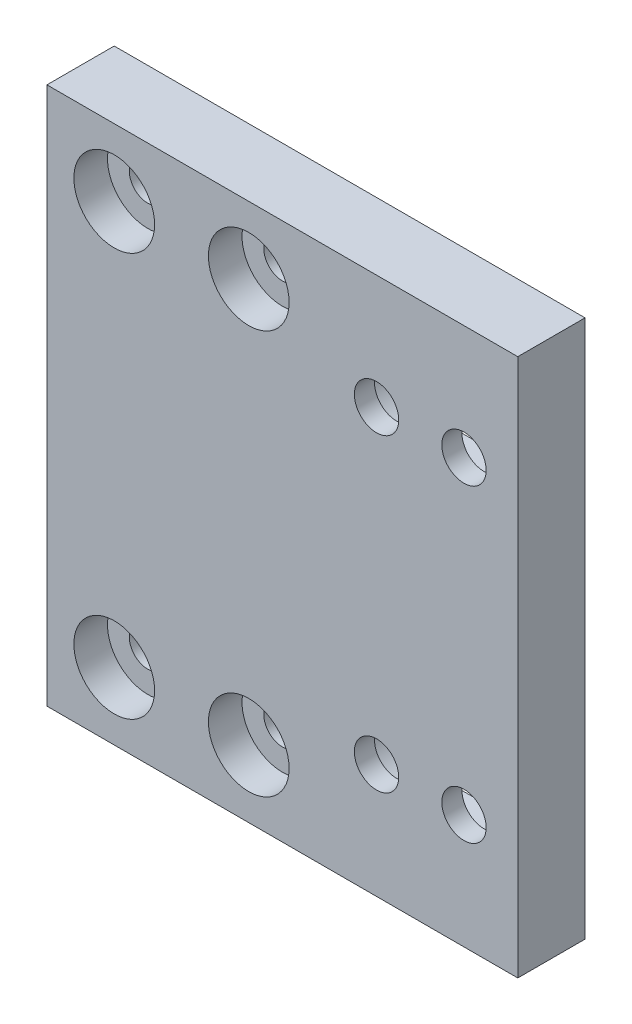
from build123d import *

# Parameters (mm, degrees)
ESQUISSE1_W             = 70
ESQUISSE1_H             = 80
ESQUISSE1_R             = 3.3
ESQUISSE1_R_2           = 2.75
BOSS_EXTRU_1_DEPTH      = 10
ESQUISSE2_R             = 6
ENL_V_MAT_EXTRU_1_DEPTH = 5
ENL_V_MAT_EXTRU_3_DEPTH = 7


with BuildPart() as part:
    # Esquisse1 → Boss.-Extru.1 (new body)
    with BuildSketch(Plane.XY):
        with Locations((-26.178136106, 1.138047212)):
            Rectangle(ESQUISSE1_W, ESQUISSE1_H)
        with Locations((0.821863894, 24.138047212)):
            Circle(ESQUISSE1_R, mode=Mode.SUBTRACT)
        with Locations((-12.178136106, 24.138047212)):
            Circle(ESQUISSE1_R, mode=Mode.SUBTRACT)
        with Locations((-12.178136106, -21.861952788)):
            Circle(ESQUISSE1_R, mode=Mode.SUBTRACT)
        with Locations((0.821863894, -21.861952788)):
            Circle(ESQUISSE1_R, mode=Mode.SUBTRACT)
        with Locations((-51.178136106, 31.138047212)):
            Circle(ESQUISSE1_R_2, mode=Mode.SUBTRACT)
        with Locations((-31.178136106, 31.138047212)):
            Circle(ESQUISSE1_R_2, mode=Mode.SUBTRACT)
        with Locations((-31.178136106, -28.861952788)):
            Circle(ESQUISSE1_R_2, mode=Mode.SUBTRACT)
        with Locations((-51.178136106, -28.861952788)):
            Circle(ESQUISSE1_R_2, mode=Mode.SUBTRACT)
    extrude(amount=BOSS_EXTRU_1_DEPTH)

    # Esquisse2 → Enlèv. mat.-Extru.1 (cut)
    with BuildSketch(Plane.XY.offset(10)):
        with Locations((-51.178136106, 31.138047212)):
            Circle(ESQUISSE2_R)
        with Locations((-31.178136106, 31.138047212)):
            Circle(ESQUISSE2_R)
        with Locations((-31.178136106, -28.861952788)):
            Circle(ESQUISSE2_R)
        with Locations((-51.178136106, -28.861952788)):
            Circle(ESQUISSE2_R)
    extrude(amount=-ENL_V_MAT_EXTRU_1_DEPTH, mode=Mode.SUBTRACT)

    # Esquisse3 → Enlèv. mat.-Extru.3 (cut)
    with BuildSketch(Plane(origin=(0, 0, 0), x_dir=(-1, 0, 0), z_dir=(0, 0, -1))):
        with BuildLine():
            Line((-0.821863894, 31.138047212), (12.178136106, 31.138047212))
            ThreePointArc((12.178136106, 31.138047212), (19.178136106, 24.138047212), (12.178136106, 17.138047212))
            Line((12.178136106, 17.138047212), (-0.821863894, 17.138047212))
            ThreePointArc((-0.821863894, 17.138047212), (-7.821863894, 24.138047212), (-0.821863894, 31.138047212))
        make_face()
        with BuildLine():
            Line((-0.821863894, -14.861952788), (12.178136106, -14.861952788))
            ThreePointArc((12.178136106, -14.861952788), (19.178136106, -21.861952788), (12.178136106, -28.861952788))
            Line((12.178136106, -28.861952788), (-0.821863894, -28.861952788))
            ThreePointArc((-0.821863894, -28.861952788), (-7.821863894, -21.861952788), (-0.821863894, -14.861952788))
        make_face()
    extrude(amount=-ENL_V_MAT_EXTRU_3_DEPTH, mode=Mode.SUBTRACT)


solid = part.part
